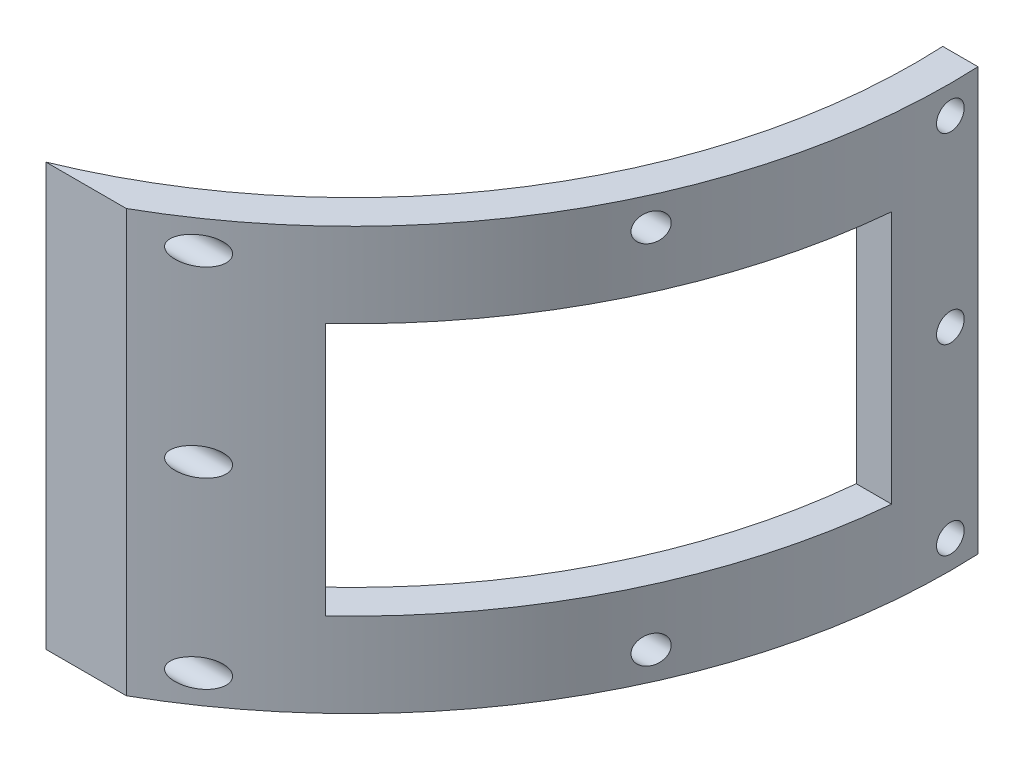
from build123d import *

# Parameters (mm, degrees)
SKETCH2_W               = 78.74
SKETCH2_H               = 55.88
SKETCH2_W_2             = 68.58
SKETCH2_H_2             = 45.72
BOSS_EXTRUDE1_DEPTH     = 203.2
SKETCH2_3_W             = 99.06
SKETCH2_3_H             = 76.2
SKETCH2_3_R             = 2.5
SKETCH2_3_W_2           = 78.74
SKETCH2_3_H_2           = 55.88
BOSS_EXTRUDE2_DEPTH     = 107.95
CUT_EXTRUDE1_DEPTH      = 235.90537414
CUT_EXTRUDE1_DEPTH_BACK = 235.90537414
SKETCH1_R               = 101.6
CUT_EXTRUDE3_DEPTH      = 235.905374211
CUT_EXTRUDE3_DEPTH_BACK = 235.905374211
SKETCH3_R               = 615.95
SKETCH3_R_2             = 107.95


with BuildPart() as part:
    # Sketch2 → Boss-Extrude1 (new body)
    with BuildSketch(Plane(origin=(0, 0, 0), x_dir=(0, 0, -1), z_dir=(1, 0, 0))):
        with Locations((-44.45, -33.02)):
            Rectangle(SKETCH2_W, SKETCH2_H)
        with Locations((-44.45, -33.02)):
            Rectangle(SKETCH2_W_2, SKETCH2_H_2, mode=Mode.SUBTRACT)
    extrude(amount=BOSS_EXTRUDE1_DEPTH)

    # Sketch2<3> → Boss-Extrude2 (add)
    with BuildSketch(Plane(origin=(0, 0, 0), x_dir=(0, 0, -1), z_dir=(1, 0, 0))):
        with Locations((-44.45, -33.02)):
            Rectangle(SKETCH2_3_W, SKETCH2_3_H)
        with Locations((-88.9, -66.04)):
            Circle(SKETCH2_3_R, mode=Mode.SUBTRACT)
        with Locations((-88.9, -33.02)):
            Circle(SKETCH2_3_R, mode=Mode.SUBTRACT)
        with Locations((-44.45, -66.04)):
            Circle(SKETCH2_3_R, mode=Mode.SUBTRACT)
        with Locations((0, -66.04)):
            Circle(SKETCH2_3_R, mode=Mode.SUBTRACT)
        with Locations((-88.9, 0)):
            Circle(SKETCH2_3_R, mode=Mode.SUBTRACT)
        with Locations((-44.45, -33.02)):
            Rectangle(SKETCH2_3_W_2, SKETCH2_3_H_2, mode=Mode.SUBTRACT)
        with Locations((0, -33.02)):
            Circle(SKETCH2_3_R, mode=Mode.SUBTRACT)
        with Locations((-44.45, 0)):
            Circle(SKETCH2_3_R, mode=Mode.SUBTRACT)
        Circle(SKETCH2_3_R, mode=Mode.SUBTRACT)
    extrude(amount=BOSS_EXTRUDE2_DEPTH)

    # Sketch1 → Cut-Extrude1 (cut, two sides: drawn at the far end of the back side and taken through both)
    with BuildSketch(Plane(origin=(0, 0, 0), x_dir=(1, 0, 0), z_dir=(0, 1, 0)).offset(-CUT_EXTRUDE1_DEPTH_BACK)):
        Circle(SKETCH1_R)
    extrude(amount=CUT_EXTRUDE1_DEPTH + CUT_EXTRUDE1_DEPTH_BACK, mode=Mode.SUBTRACT)

    # Sketch3 → Cut-Extrude3 (cut, two sides: drawn at the far end of the back side and taken through both)
    with BuildSketch(Plane(origin=(0, 0, 0), x_dir=(1, 0, 0), z_dir=(0, 1, 0)).offset(-CUT_EXTRUDE3_DEPTH_BACK)):
        Circle(SKETCH3_R)
        Circle(SKETCH3_R_2, mode=Mode.SUBTRACT)
    extrude(amount=CUT_EXTRUDE3_DEPTH + CUT_EXTRUDE3_DEPTH_BACK, mode=Mode.SUBTRACT)


solid = part.part
